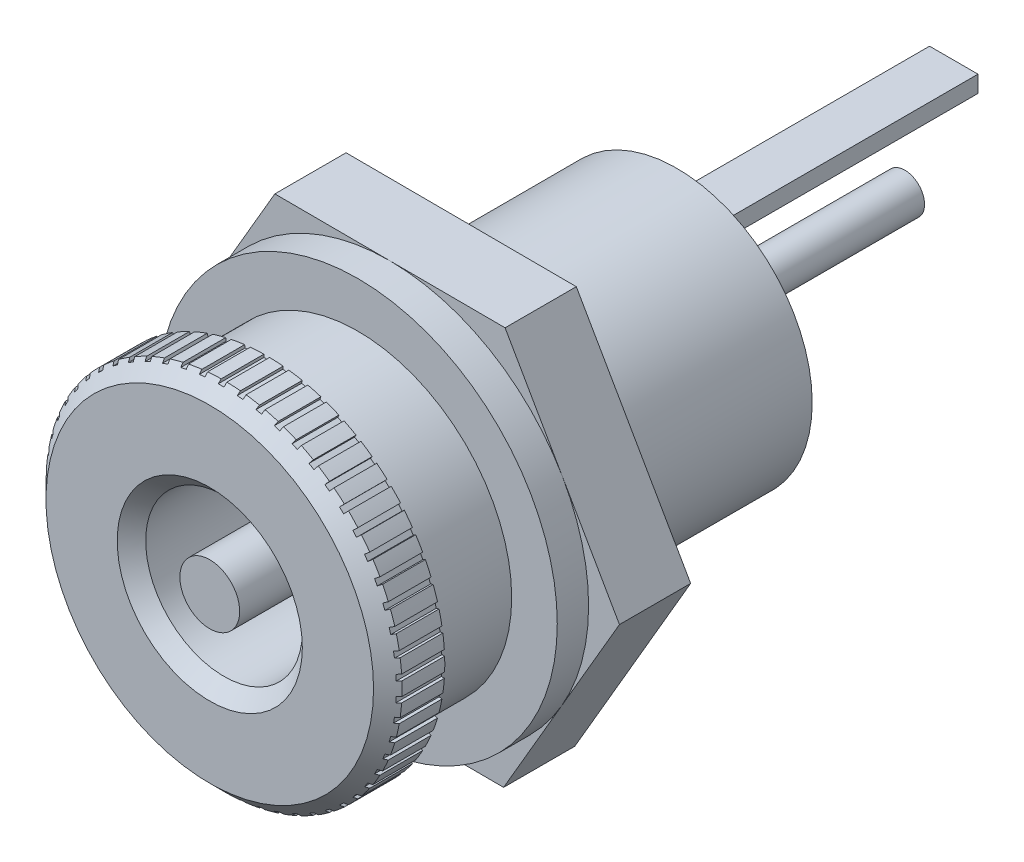
from build123d import *

# Parameters (mm, degrees)
SKETCH_1_R               = 6.25
EXTRUDE_1_DEPTH          = 2
SKETCH_2_R               = 4.75
EXTRUDE_2_DEPTH          = 16.4
SKETCH_4_W               = 1.70155497
SKETCH_4_H               = 0.586743093
EXTRUDE_3_DEPTH          = 9.7
SKETCH_5_R               = 0.694932183
EXTRUDE_4_DEPTH          = 8
SKETCH_6_R               = 5.4
EXTRUDE_5_DEPTH          = 7.8
SKETCH_3_R               = 2.75
SKETCH_3_R_2             = 1.05
CUT_EXTRUDE_1_DEPTH      = 12
CHAMFER_1_SIZE           = 0.5
CHAMFER_2_SIZE           = 0.5
SKETCH_7_W               = 0.2
SKETCH_7_H               = 0.997839601
CUT_EXTRUDE_2_DEPTH      = 28.556033822
PATTERN_CIRCULAR_1_COUNT = 58
EXTRUDE_6_DEPTH          = 2.5
SKETCH_9_R               = 7
EXTRUDE_7_DEPTH          = 1.1


with BuildPart() as part:
    # 草图1 → 凸台-拉伸1 (new body)
    with BuildSketch(Plane.XY):
        Circle(SKETCH_1_R)
    extrude(amount=EXTRUDE_1_DEPTH)

    # 草图2 → 凸台-拉伸2 (add)
    with BuildSketch(Plane.XY.offset(2)):
        Circle(SKETCH_2_R)
    extrude(amount=-EXTRUDE_2_DEPTH)

    # 草图4 → 凸台-拉伸3 (add)
    with BuildSketch(Plane(origin=(0, 0, -14.4), x_dir=(-1, 0, 0), z_dir=(0, 0, -1))):
        with Locations((-0.019558103, 2.904378312)):
            Rectangle(SKETCH_4_W, SKETCH_4_H)
    extrude(amount=EXTRUDE_3_DEPTH)

    # 草图5 → 凸台-拉伸4 (add)
    with BuildSketch(Plane(origin=(0, 0, -14.4), x_dir=(-1, 0, 0), z_dir=(0, 0, -1))):
        with Locations(Location((0, 0, 0), (0, 0, 180))):
            Circle(SKETCH_5_R)
    extrude(amount=EXTRUDE_4_DEPTH)

    # 草图6 → 凸台-拉伸5 (add)
    with BuildSketch(Plane(origin=(0, 0, 0), x_dir=(-1, 0, 0), z_dir=(0, 0, -1))):
        with Locations(Location((0, 0, 0), (0, 0, 180))):
            Circle(SKETCH_6_R)
    extrude(amount=EXTRUDE_5_DEPTH)

    # 草图3 → 切除-拉伸1 (cut)
    with BuildSketch(Plane.XY.offset(2)):
        Circle(SKETCH_3_R)
        Circle(SKETCH_3_R_2, mode=Mode.SUBTRACT)
    extrude(amount=-CUT_EXTRUDE_1_DEPTH, mode=Mode.SUBTRACT)

    # 倒角1
    chamfer_1_edges = [part.edges().sort_by_distance(p)[0] for p in [
        (-6.25, 0, 2),
    ]]
    chamfer(chamfer_1_edges, length=CHAMFER_1_SIZE)

    # 倒角2
    chamfer_2_edges = [part.edges().sort_by_distance(p)[0] for p in [
        (-2.75, 0, 2),
    ]]
    chamfer(chamfer_2_edges, length=CHAMFER_2_SIZE)

    # 草图7 → 切除-拉伸2 (cut, through all)
    with BuildSketch(Plane.XY.offset(2)):
        with Locations((0, 6.647820837)):
            Rectangle(SKETCH_7_W, SKETCH_7_H)
    cut_extrude_2 = extrude(amount=-CUT_EXTRUDE_2_DEPTH, mode=Mode.SUBTRACT)

    # 阵列(圆周)1: 切除-拉伸2 ×58 about axis
    pattern_circular_1_axis = Axis((0, 0, 0), (0, 0, 1))
    for i in range(1, PATTERN_CIRCULAR_1_COUNT):
        add(cut_extrude_2.rotate(pattern_circular_1_axis, i * 360 / PATTERN_CIRCULAR_1_COUNT), mode=Mode.SUBTRACT)

    # 草图8 → 凸台-拉伸6 (add)
    with BuildSketch(Plane(origin=(0, 0, -6.8), x_dir=(-1, 0, 0), z_dir=(0, 0, -1))):
        Polygon((-4.067701821, 6.984778824), (-8.082846812, -0.0303437), (-4.015144991, -7.015122524), (4.067701821, -6.984778824), (8.082846812, 0.0303437), (4.015144991, 7.015122524), align=None)
    extrude(amount=-EXTRUDE_6_DEPTH)

    # 草图9 → 凸台-拉伸7 (add)
    with BuildSketch(Plane.XY.offset(-4.3)):
        with Locations(Location((0, 0, 0), (0, 0, 209.784907742))):
            Circle(SKETCH_9_R)
    extrude(amount=EXTRUDE_7_DEPTH)


solid = part.part
